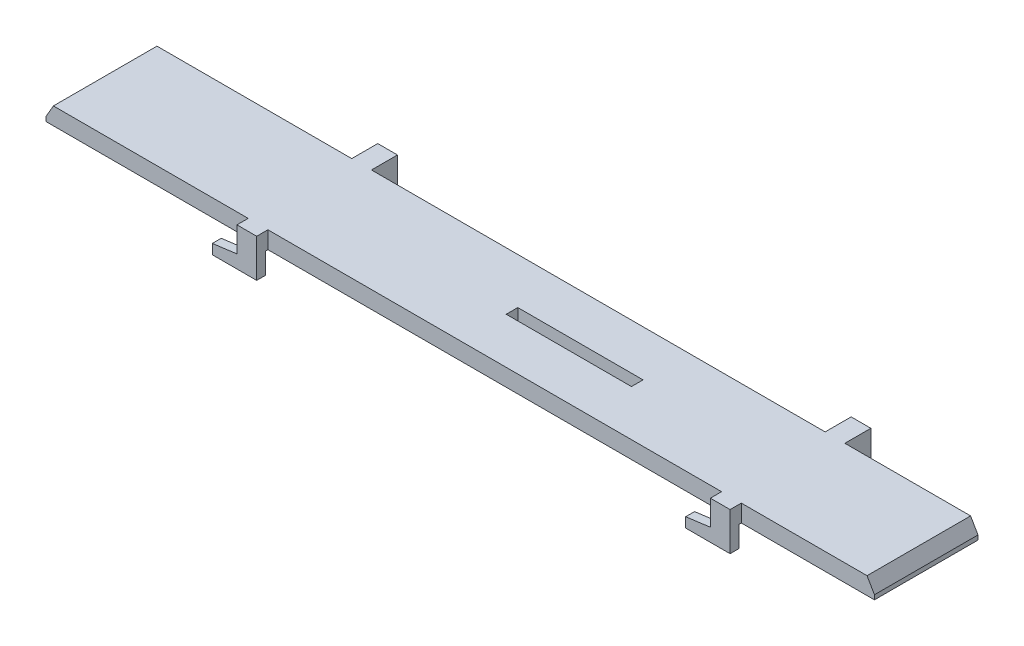
from build123d import *
from OCP.BRepFilletAPI import BRepFilletAPI_MakeChamfer

# Parameters (mm, degrees)
THICKNESS_EXTRUDE_DEPTH     = 3.5
HOOK_1_EXTRUDE_DEPTH        = 0.9
HOOK_START                  = -26.75
HOOK_2_EXTRUDE_DEPTH        = 0.9
HOOK_PATTERN_COUNT          = 2
HOOK_PATTERN_PITCH          = 96
HANDLE_SKETCH_W             = 25.4
HANDLE_SKETCH_H             = 2.35
HANDLE_SLOT_CUT_DEPTH       = 3
HANDLE_SLOT_CHAMFER_1_SIZE  = 1.175
HANDLE_SLOT_CHAMFER_1_SIZE2 = 2.836700936
END_CHAMFERS_SIZE           = 2.6
END_CHAMFERS_SIZE2          = 1.5011107


with BuildPart() as part:
    # Top Sketch → Thickness Extrude (new body)
    with BuildSketch(Plane(origin=(0, 0, 0), x_dir=(1, 0, 0), z_dir=(0, 1, 0))):
        Polygon((-27, -11), (-27, -12.375), (-31, -12.375), (-31, -11), (-123, -11), (-123, -12.375), (-127, -12.375), (-127, -11), (-168, -11), (-168, 10), (-127, 10), (-127, 14.375), (-123, 14.375), (-123, 10), (-31, 10), (-31, 14.375), (-27, 14.375), (-27, 10), (0, 10), (0, -11), align=None)
    extrude(amount=THICKNESS_EXTRUDE_DEPTH)


with BuildPart() as body_2:
    # Hook Sketch → Hook 1 Extrude (new, symmetric)
    with BuildSketch(Plane.XY.offset(12.375)):
        Polygon((-31, 3.5), (-27, 3.5), (-27, -4.258262488), (-36, -4.258262488), (-36, -2.258262488), (-31, -1.6), align=None)
    hook_1_extrude = extrude(amount=HOOK_1_EXTRUDE_DEPTH, both=True)


with BuildPart() as body_3:
    # Hook Sketch<2> → Hook 2 Extrude (new, symmetric)
    with BuildSketch(Plane.XY.offset(12.375).offset(HOOK_START)):
        Polygon((-31, 3.5), (-27, 3.5), (-27, -4.258262488), (-36, -4.258262488), (-36, -2.258262488), (-31, -1.6), align=None)
    hook_2_extrude = extrude(amount=HOOK_2_EXTRUDE_DEPTH, both=True)


with BuildPart() as hook_pattern_1:
    # Hook Pattern: pattern copy
    add(hook_1_extrude.moved(Location(Vector(-1, 0, 0) * (1 * HOOK_PATTERN_PITCH))))


with BuildPart() as hook_pattern_2:
    # Hook Pattern: pattern copy
    add(hook_2_extrude.moved(Location(Vector(-1, 0, 0) * (1 * HOOK_PATTERN_PITCH))))


with BuildPart() as part_1:
    add(part.part)

    # Combine Bodies: union body 2, body 3, Hook Pattern_1, Hook Pattern_2
    add(body_2.part)
    add(body_3.part)
    add(hook_pattern_1.part)
    add(hook_pattern_2.part)

    # Handle Sketch → Handle Slot Cut (cut)
    with BuildSketch(Plane(origin=(0, 3.5, 0), x_dir=(1, 0, 0), z_dir=(0, 1, 0))):
        with Locations((-71.3, -0.5)):
            Rectangle(HANDLE_SKETCH_W, HANDLE_SKETCH_H)
    extrude(amount=-HANDLE_SLOT_CUT_DEPTH, mode=Mode.SUBTRACT)

    # Handle Slot Chamfer 1
    handle_slot_chamfer_1_edges = [part_1.edges().sort_by_distance(p)[0] for p in [
        (-71.3, 0.5, 1.675),
    ]]
    handle_slot_chamfer_1_side = [part_1.faces().sort_by_distance(p)[0] for p in [
        (-71.3, 0.5, 0.5),
    ]]
    chamfer(handle_slot_chamfer_1_edges, length=HANDLE_SLOT_CHAMFER_1_SIZE, length2=HANDLE_SLOT_CHAMFER_1_SIZE2, reference=handle_slot_chamfer_1_side[0])

    # End Chamfers: one chamfer whose edges measure the first distance from different faces: ONE call of the kernel's chamfer builder (chamfer() names one face for all edges)
    end_chamfers_edges_1 = [part_1.edges().sort_by_distance(p)[0] for p in [
        (0, 3.5, 0.5),
    ]]
    end_chamfers_side_1 = [part_1.faces().sort_by_distance(p)[0] for p in [
        (0, 1.75, 0.5),
    ]]
    end_chamfers_edges_2 = [part_1.edges().sort_by_distance(p)[0] for p in [
        (-168, 3.5, 0.5),
    ]]
    end_chamfers_side_2 = [part_1.faces().sort_by_distance(p)[0] for p in [
        (-168, 1.75, 0.5),
    ]]
    end_chamfers = BRepFilletAPI_MakeChamfer(part_1.part.solid().wrapped)
    for e in end_chamfers_edges_1:
        end_chamfers.Add(END_CHAMFERS_SIZE, END_CHAMFERS_SIZE2, e.wrapped, end_chamfers_side_1[0].wrapped)  # the first distance lies on this face
    for e in end_chamfers_edges_2:
        end_chamfers.Add(END_CHAMFERS_SIZE, END_CHAMFERS_SIZE2, e.wrapped, end_chamfers_side_2[0].wrapped)  # the first distance lies on this face
    add(Compound.cast(end_chamfers.Shape()), mode=Mode.REPLACE)


solid = part_1.part
